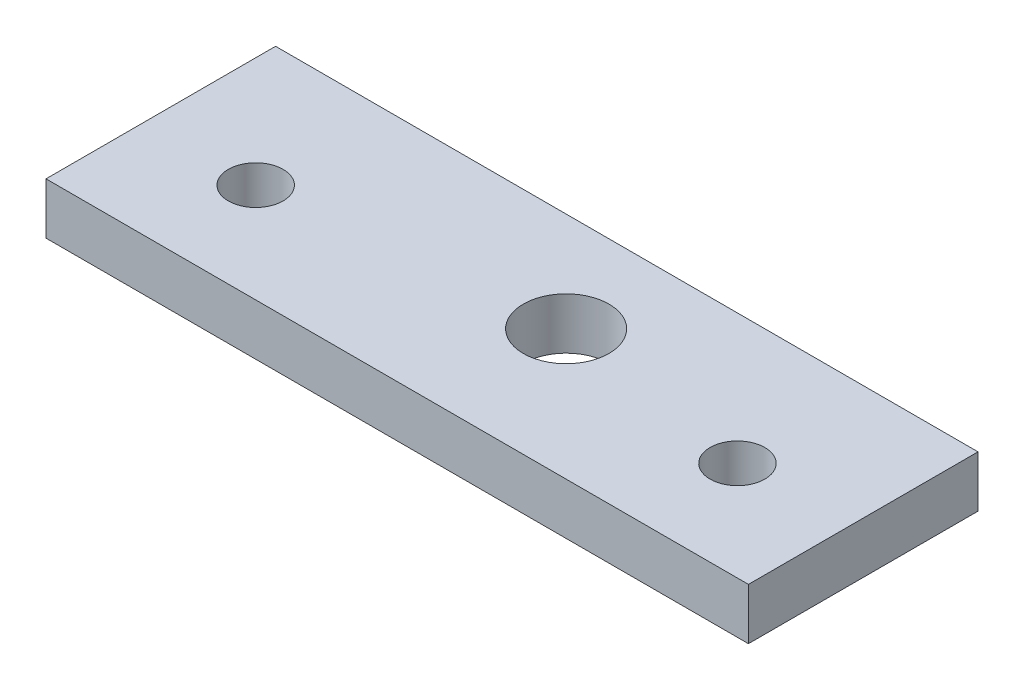
from build123d import *

# Parameters (mm, degrees)
SKETCH1_W           = 20.5
SKETCH1_H           = 6.7
SKETCH1_R           = 0.8
SKETCH1_R_2         = 1.25
BOSS_EXTRUDE1_DEPTH = 1.5


with BuildPart() as part:
    # Sketch1 → Boss-Extrude1 (new body)
    with BuildSketch(Plane(origin=(0, 0, 0), x_dir=(1, 0, 0), z_dir=(0, 1, 0))):
        with Locations((0.728779623, 1.302409488)):
            Rectangle(SKETCH1_W, SKETCH1_H)
        with Locations(Location((-6.301220377, 0.852409488, 0), (0, 0, 270))):
            Circle(SKETCH1_R, mode=Mode.SUBTRACT)
        with Locations(Location((1.858779623, 1.752409488, 0), (0, 0, 270))):
            Circle(SKETCH1_R_2, mode=Mode.SUBTRACT)
        with Locations(Location((7.758779623, 0.852409488, 0), (0, 0, 270))):
            Circle(SKETCH1_R, mode=Mode.SUBTRACT)
    extrude(amount=BOSS_EXTRUDE1_DEPTH)


solid = part.part
